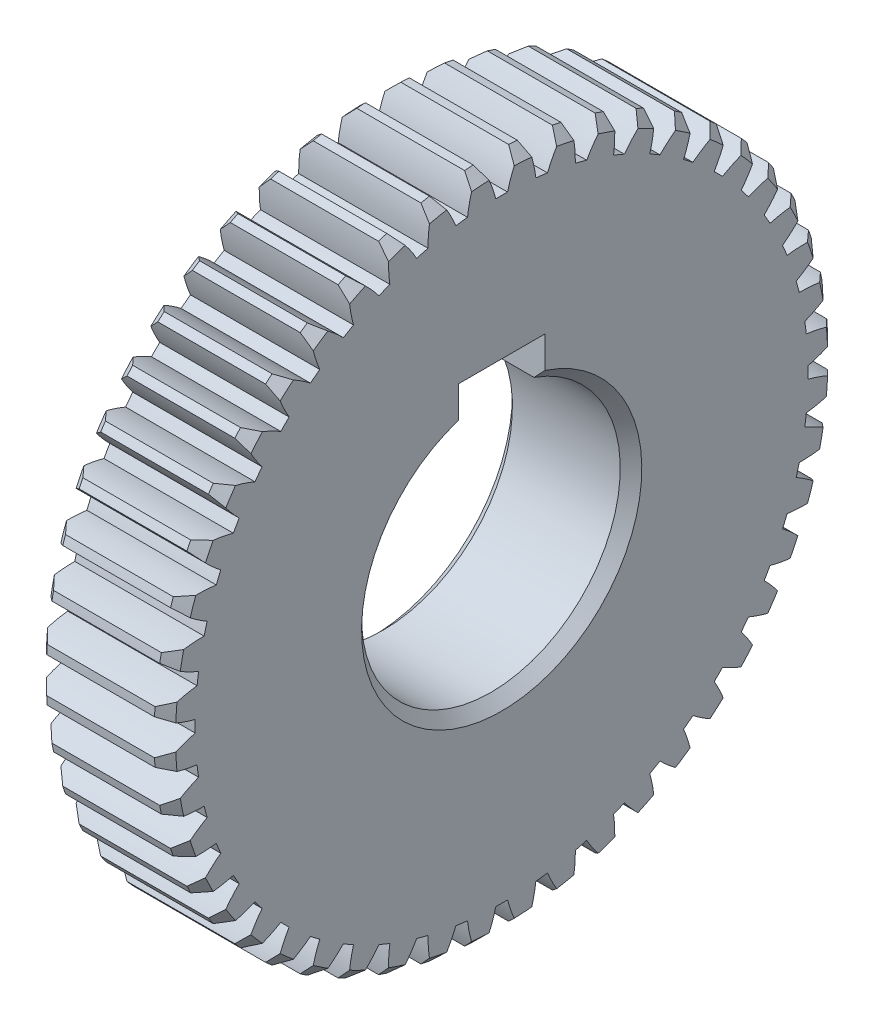
from build123d import *

# Parameters (mm, degrees)
BASPROSKE_W     = 12
BASPROSKE_H     = 31.25
TOOTHCUT_DEPTH  = 46.794377384
TEETHCUTS_COUNT = 48
TEETHCUTS_ANGLE = 352.5
BORSKE_R        = 12
BORE_DEPTH      = 50.0000508
KEYSKE_W        = 8
KEYSKE_H        = 15.3
KEYWAY_DEPTH    = 50.0000508
CHAMFER1_SIZE   = 1
CHAMFER2_SIZE   = 1


with BuildPart() as part:
    # BasProSke → Base-Revolve (revolve)
    with BuildSketch(Plane(origin=(0, 0, 0), x_dir=(1, 0, 0), z_dir=(0, 1, 0)), mode=Mode.PRIVATE) as base_revolve_sk:
        with Locations((6, 15.625)):
            Rectangle(BASPROSKE_W, BASPROSKE_H)
    revolve(base_revolve_sk.sketch.rotate(Axis((-10, 0, 0), (1, 0, 0)), 180), axis=Axis((-10, 0, 0), (1, 0, 0)))

    # TooCutSke → ToothCut (cut, through all)
    with BuildSketch(Plane(origin=(0, 0, 0), x_dir=(0, 0, -1), z_dir=(1, 0, 0))):
        with BuildLine():
            ThreePointArc((0.545315325, 28.431270873), (0, 28.4365), (-0.545315325, 28.431270873))
            ThreePointArc((-0.545315325, 28.431270873), (-1.013949984, 29.866417699), (-1.659074458, 31.231364317))
            ThreePointArc((-1.659074458, 31.231364317), (0, 31.2754), (1.659074458, 31.231364317))
            ThreePointArc((1.659074458, 31.231364317), (1.013949984, 29.866417699), (0.545315325, 28.431270873))
        make_face()
    toothcut = extrude(amount=TOOTHCUT_DEPTH, mode=Mode.SUBTRACT)

    # TeethCuts: ToothCut ×48 about axis
    teethcuts_axis = Axis((-10, 0, 0), (1, 0, 0))
    for i in range(1, TEETHCUTS_COUNT):
        add(toothcut.rotate(teethcuts_axis, i * TEETHCUTS_ANGLE / (TEETHCUTS_COUNT - 1)), mode=Mode.SUBTRACT)

    # BorSke → Bore (cut, symmetric)
    with BuildSketch(Plane(origin=(0, 0, 0), x_dir=(0, 0, -1), z_dir=(1, 0, 0))):
        with Locations(Location((0, 0, 0), (0, 0, 180))):
            Circle(BORSKE_R)
    extrude(amount=BORE_DEPTH, both=True, mode=Mode.SUBTRACT)

    # KeySke → Keyway (cut, symmetric)
    with BuildSketch(Plane(origin=(0, 0, 0), x_dir=(0, 0, -1), z_dir=(1, 0, 0))):
        with Locations((0, 7.65)):
            Rectangle(KEYSKE_W, KEYSKE_H)
    extrude(amount=KEYWAY_DEPTH, both=True, mode=Mode.SUBTRACT)

    # Chamfer1
    chamfer1_edges = [part.edges().sort_by_distance(p)[0] for p in [
        (0, -12, 0),
        (12, -12, 0),
    ]]
    chamfer(chamfer1_edges, length=CHAMFER1_SIZE)

    # Chamfer2
    chamfer2_edges = [part.edges().sort_by_distance(p)[0] for p in [
        (12, 31.183091351, -2.043847788),
        (12, 30.649540013, -6.096572563),
        (12, 29.591566547, -10.044983291),
        (12, 28.027273173, -13.821521569),
        (12, 25.983425384, -17.361569782),
        (12, 23.494993984, -20.604556722),
        (12, 20.604556722, -23.494993984),
        (12, 17.361569782, -25.983425384),
        (12, 13.821521569, -28.027273173),
        (12, 10.044983291, -29.591566547),
        (12, 6.096572563, -30.649540013),
        (12, 2.043847788, -31.183091351),
        (12, -2.043847788, -31.183091351),
        (12, -6.096572563, -30.649540013),
        (12, -10.044983291, -29.591566547),
        (12, -13.821521569, -28.027273173),
        (12, -17.361569782, -25.983425384),
        (12, -20.604556722, -23.494993984),
        (12, -23.494993984, -20.604556722),
        (12, -25.983425384, -17.361569782),
        (12, -28.027273173, -13.821521569),
        (12, -29.591566547, -10.044983291),
        (12, -30.649540013, -6.096572563),
        (12, -31.183091351, -2.043847788),
        (12, -31.183091351, 2.043847788),
        (12, -30.649540013, 6.096572563),
        (12, -29.591566547, 10.044983291),
        (12, -28.027273173, 13.821521569),
        (12, -25.983425384, 17.361569782),
        (12, -23.494993984, 20.604556722),
        (12, -20.604556722, 23.494993984),
        (12, -17.361569782, 25.983425384),
        (12, -13.821521569, 28.027273173),
        (12, -10.044983291, 29.591566547),
        (12, -6.096572563, 30.649540013),
        (12, -2.043847788, 31.183091351),
        (12, 2.043847788, 31.183091351),
        (12, 6.096572563, 30.649540013),
        (12, 10.044983291, 29.591566547),
        (12, 13.821521569, 28.027273173),
        (12, 17.361569782, 25.983425384),
        (12, 20.604556722, 23.494993984),
        (12, 23.494993984, 20.604556722),
        (12, 25.983425384, 17.361569782),
        (12, 28.027273173, 13.821521569),
        (12, 29.591566547, 10.044983291),
        (12, 30.649540013, 6.096572563),
        (0, 31.183091351, 2.043847788),
        (12, 31.183091351, 2.043847788),
        (0, 30.649540013, -6.096572563),
        (0, 29.591566547, -10.044983291),
        (0, 28.027273173, -13.821521569),
        (0, 25.983425384, -17.361569782),
        (0, 23.494993984, -20.604556722),
        (0, 20.604556722, -23.494993984),
        (0, 17.361569782, -25.983425384),
        (0, 13.821521569, -28.027273173),
        (0, 10.044983291, -29.591566547),
        (0, 6.096572563, -30.649540013),
        (0, 2.043847788, -31.183091351),
        (0, -2.043847788, -31.183091351),
        (0, -6.096572563, -30.649540013),
        (0, -10.044983291, -29.591566547),
        (0, -13.821521569, -28.027273173),
        (0, -17.361569782, -25.983425384),
        (0, -20.604556722, -23.494993984),
        (0, -23.494993984, -20.604556722),
        (0, -25.983425384, -17.361569782),
        (0, -28.027273173, -13.821521569),
        (0, -29.591566547, -10.044983291),
        (0, -30.649540013, -6.096572563),
        (0, -31.183091351, -2.043847788),
        (0, -31.183091351, 2.043847788),
        (0, -30.649540013, 6.096572563),
        (0, -29.591566547, 10.044983291),
        (0, -28.027273173, 13.821521569),
        (0, -25.983425384, 17.361569782),
        (0, -23.494993984, 20.604556722),
        (0, -20.604556722, 23.494993984),
        (0, -17.361569782, 25.983425384),
        (0, -13.821521569, 28.027273173),
        (0, -10.044983291, 29.591566547),
        (0, -6.096572563, 30.649540013),
        (0, -2.043847788, 31.183091351),
        (0, 2.043847788, 31.183091351),
        (0, 6.096572563, 30.649540013),
        (0, 10.044983291, 29.591566547),
        (0, 13.821521569, 28.027273173),
        (0, 17.361569782, 25.983425384),
        (0, 20.604556722, 23.494993984),
        (0, 23.494993984, 20.604556722),
        (0, 25.983425384, 17.361569782),
        (0, 28.027273173, 13.821521569),
        (0, 29.591566547, 10.044983291),
        (0, 30.649540013, 6.096572563),
        (0, 31.183091351, -2.043847788),
    ]]
    chamfer(chamfer2_edges, length=CHAMFER2_SIZE)


solid = part.part
